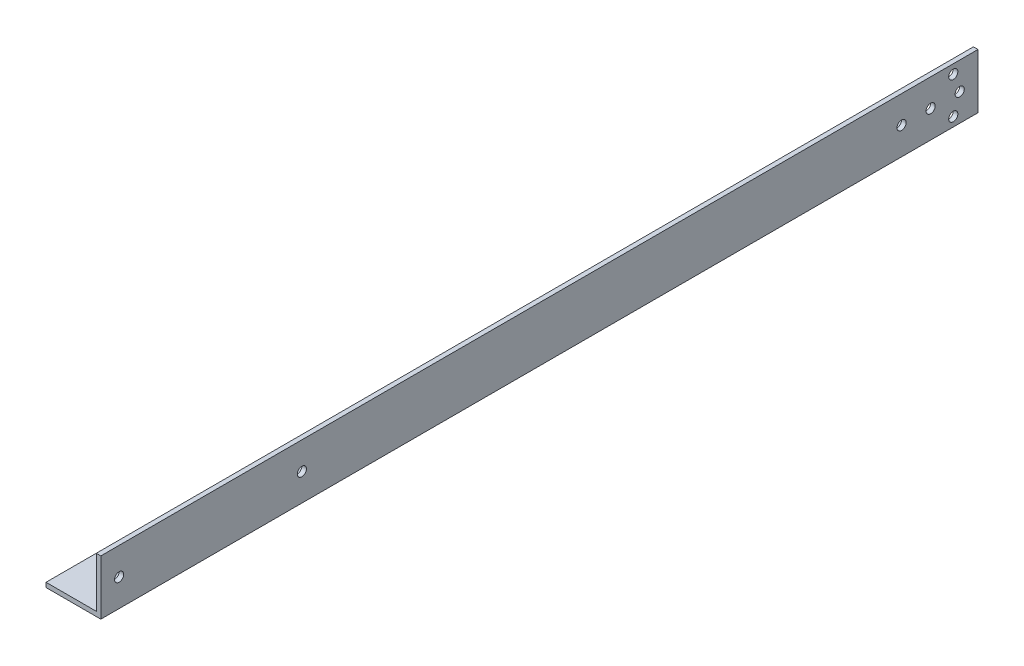
from build123d import *

# Parameters (mm, degrees)
EXTRUDE1_DEPTH     = 304.8
SKETCH2_R          = 1.5875
EXTRUDE2_DEPTH     = 1.5875
SKETCH3_R          = 1.5875
CUT_EXTRUDE3_DEPTH = 306.9883086
SKETCH6_R          = 1.5875
CUT_EXTRUDE5_DEPTH = 306.9883086
SKETCH7_W          = 17.4625
SKETCH7_H          = 11.77006403
CUT_EXTRUDE6_DEPTH = 306.893578563


with BuildPart() as part:
    # Sketch1 → Extrude1 (new body)
    with BuildSketch(Plane.XY):
        Polygon((0, 0), (0, 19.05), (-1.5875, 19.05), (-1.5875, 1.5875), (-19.05, 1.5875), (-19.05, 0), align=None)
    extrude(amount=EXTRUDE1_DEPTH)

    # Sketch2 → Extrude2 (cut)
    with BuildSketch(Plane(origin=(0, 0, 0), x_dir=(0, 0, -1), z_dir=(1, 0, 0))):
        with Locations((-298.45, 9.525)):
            Circle(SKETCH2_R)
        with Locations((-234.95, 9.525)):
            Circle(SKETCH2_R)
    extrude(amount=-EXTRUDE2_DEPTH, mode=Mode.SUBTRACT)

    # Sketch3 → Cut-Extrude3 (cut, through all)
    with BuildSketch(Plane(origin=(0, 0, 0), x_dir=(0, 0, -1), z_dir=(1, 0, 0))):
        with Locations((-26.555576272, 9.525)):
            Circle(SKETCH3_R)
        with Locations((-16.452788136, 9.525)):
            Circle(SKETCH3_R)
    extrude(amount=-CUT_EXTRUDE3_DEPTH, mode=Mode.SUBTRACT)

    # Sketch6 → Cut-Extrude5 (cut, through all)
    with BuildSketch(Plane(origin=(0, 0, 0), x_dir=(0, 0, -1), z_dir=(1, 0, 0))):
        with Locations((-8.59506403, 15.875)):
            Circle(SKETCH6_R)
        with Locations((-8.59506403, 3.175)):
            Circle(SKETCH6_R)
        with Locations((-6.35, 9.525)):
            Circle(SKETCH6_R)
    extrude(amount=-CUT_EXTRUDE5_DEPTH, mode=Mode.SUBTRACT)

    # Sketch7 → Cut-Extrude6 (cut, through all)
    with BuildSketch(Plane(origin=(0, 1.5875, 0), x_dir=(1, 0, 0), z_dir=(0, 1, 0))):
        with Locations((-10.31875, -5.885032015)):
            Rectangle(SKETCH7_W, SKETCH7_H)
    extrude(amount=-CUT_EXTRUDE6_DEPTH, mode=Mode.SUBTRACT)


solid = part.part
